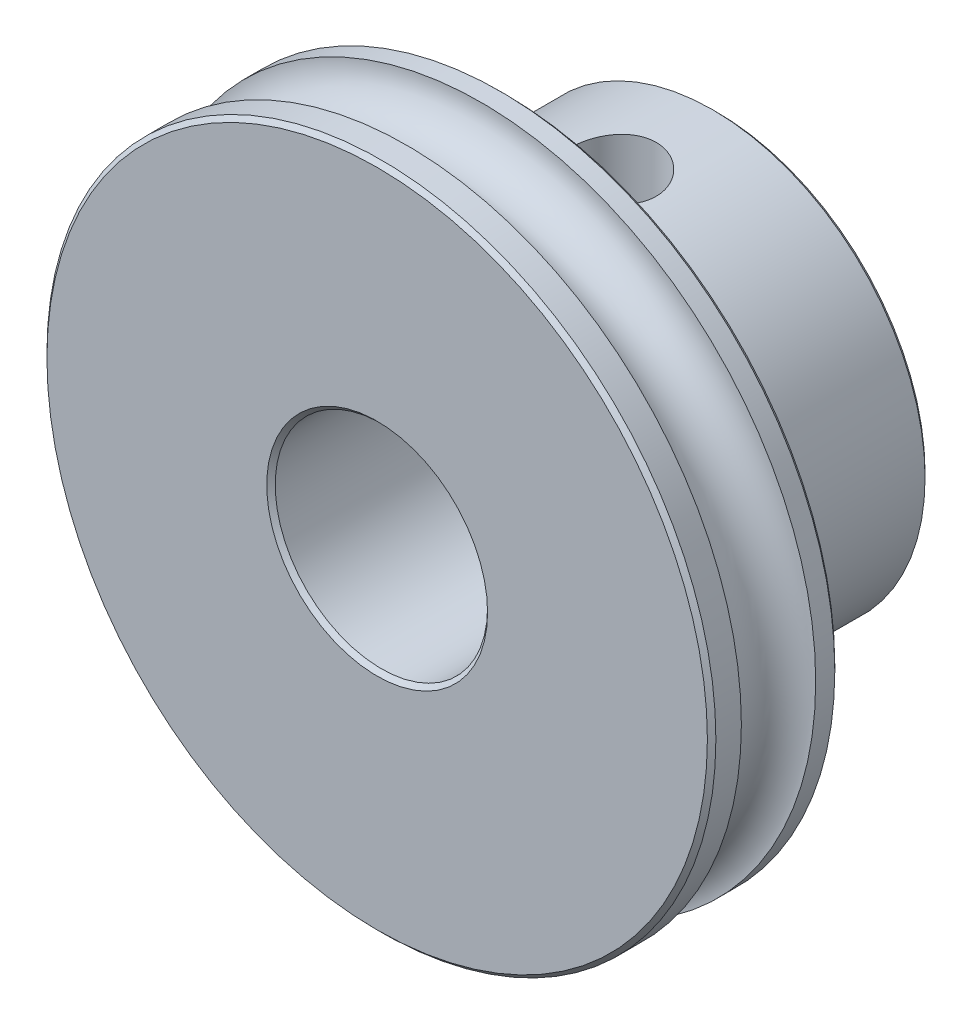
from build123d import *

# Parameters (mm, degrees)
SKETCH_2_W               = 2
SKETCH_2_H               = 21.51490011
PATTERN_CIRCULAR_1_COUNT = 2
PATTERN_CIRCULAR_1_ANGLE = 120
CHAMFER_1_SIZE           = 0.2
CHAMFER_2_SIZE           = 0.5


with BuildPart() as part:
    # 草图1 → 旋转1 (revolve)
    with BuildSketch(Plane(origin=(0, 0, 0), x_dir=(0, 0, -1), z_dir=(1, 0, 0)), mode=Mode.PRIVATE) as revolve_1_sk:
        with BuildLine():
            Line((0.861588836, 5), (16.861588836, 5))
            Line((16.861588836, 5), (16.861588836, 10))
            Line((16.861588836, 10), (6.861588836, 10))
            Line((6.861588836, 10), (6.861588836, 15.75))
            Line((6.861588836, 15.75), (5.761588836, 15.75))
            ThreePointArc((5.761588836, 15.75), (4.011588836, 14), (2.261588836, 15.75))
            Line((2.261588836, 15.75), (0.861588836, 15.75))
            Line((0.861588836, 15.75), (0.861588836, 5))
        make_face()
    revolve(revolve_1_sk.sketch.rotate(Axis((0, 0, 0), (0, 0, -1)), 90), axis=Axis((0, 0, 0), (0, 0, -1)))

    # 草图2 → M4 螺纹孔1 (revolve, cut)
    with BuildSketch(Plane(origin=(0, 0, -12), x_dir=(0, 0, -1), z_dir=(1, 0, 0))):
        with Locations((1, 10.757450055)):
            Rectangle(SKETCH_2_W, SKETCH_2_H)
    hole_wizard_m4_1 = revolve(axis=Axis((0, -6.35, -12), (0, 1, 0)), mode=Mode.SUBTRACT)

    # 阵列(圆周)1: M4 螺纹孔1 ×2 about axis
    pattern_circular_1_axis = Axis((0, 0, 0), (0, 0, 1))
    for i in range(1, PATTERN_CIRCULAR_1_COUNT):
        add(hole_wizard_m4_1.rotate(pattern_circular_1_axis, i * PATTERN_CIRCULAR_1_ANGLE / (PATTERN_CIRCULAR_1_COUNT - 1)), mode=Mode.SUBTRACT)

    # 倒角1
    chamfer_1_edges = [part.edges().sort_by_distance(p)[0] for p in [
        (-15.75, 0, -0.861588836),
        (-15.75, 0, -6.861588836),
        (-10, 0, -16.861588836),
        (-5, 0, -16.861588836),
        (-5, 0, -0.861588836),
    ]]
    chamfer(chamfer_1_edges, length=CHAMFER_1_SIZE)

    # 倒角2
    chamfer_2_edges = [part.edges().sort_by_distance(p)[0] for p in [
        (-10, 0, -6.861588836),
    ]]
    chamfer(chamfer_2_edges, length=CHAMFER_2_SIZE)


solid = part.part
